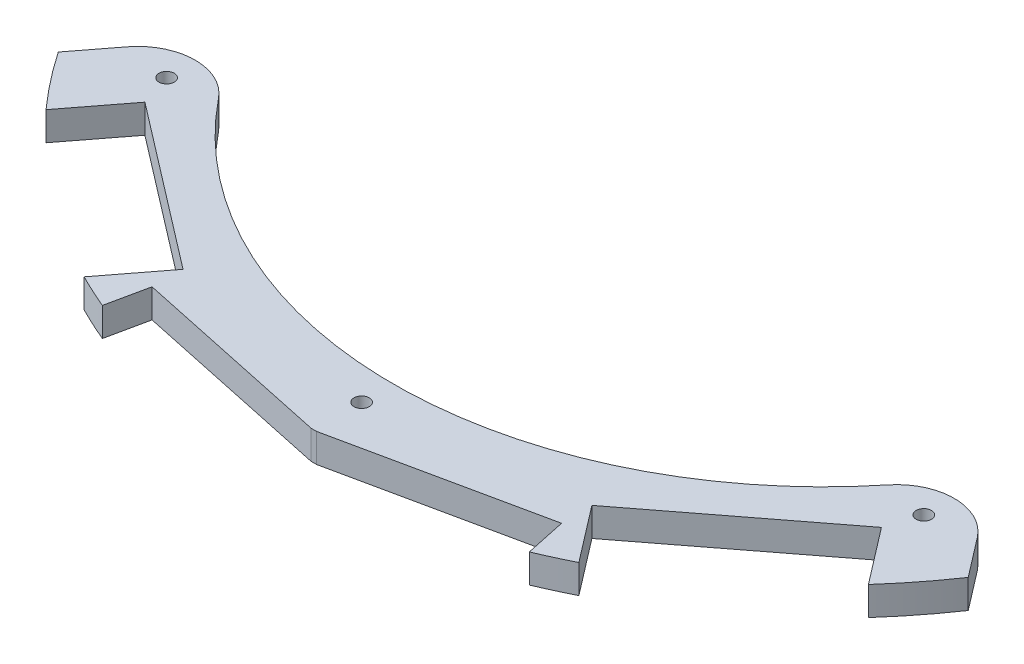
from build123d import *

# Parameters (mm, degrees)
SKETCH1_R           = 1.70053
BOSS_EXTRUDE1_DEPTH = 6.35


with BuildPart() as part:
    # Sketch1 → Boss-Extrude1 (new body)
    with BuildSketch(Plane(origin=(0, 0, 0), x_dir=(1, 0, 0), z_dir=(0, 1, 0))):
        with BuildLine():
            Line((100.72984212, 33.562647915), (94.097535909, 42.20603765))
            ThreePointArc((94.097535909, 42.20603765), (84.176111379, 47.17383179), (74.137013371, 42.448352501))
            ThreePointArc((74.137013371, 42.448352501), (0, 7.00024), (-74.137013371, 42.448352501))
            ThreePointArc((-74.137013371, 42.448352501), (-84.176111379, 47.17383179), (-94.097535909, 42.20603765))
            Line((-94.097535909, 42.20603765), (-100.72984212, 33.562647915))
            ThreePointArc((-100.72984212, 33.562647915), (-96.085326852, 27.20294582), (-91.039926176, 21.156354646))
            Line((-91.039926176, 21.156354646), (-81.532472576, 33.546709409))
            Line((-81.532472576, 33.546709409), (-63.396415217, 19.630423142))
            Line((-63.396415217, 19.630423142), (-45.260357858, 5.714136875))
            Line((-45.260357858, 5.714136875), (-54.767811458, -6.676217888))
            ThreePointArc((-54.767811458, -6.676217888), (-51.042995201, -8.470575753), (-47.259480127, -10.137606043))
            Line((-47.259480127, -10.137606043), (-45.332616871, -1.072427153))
            Line((-45.332616871, -1.072427153), (-0.611708566, -10.578149657))
            Line((-0.611708566, -10.578149657), (0.611708566, -10.578149657))
            Line((0.611708566, -10.578149657), (45.332616871, -1.072427153))
            Line((45.332616871, -1.072427153), (47.259480127, -10.137606043))
            ThreePointArc((47.259480127, -10.137606043), (51.042995201, -8.470575753), (54.767811458, -6.676217888))
            Line((54.767811458, -6.676217888), (45.260357858, 5.714136875))
            Line((45.260357858, 5.714136875), (63.396415217, 19.630423142))
            Line((63.396415217, 19.630423142), (81.532472576, 33.546709409))
            Line((81.532472576, 33.546709409), (91.039926176, 21.156354646))
            ThreePointArc((91.039926176, 21.156354646), (96.085326852, 27.20294582), (100.72984212, 33.562647915))
        make_face()
        with Locations(Location((83.82, 40.64, 0), (0, 0, 270))):
            Circle(SKETCH1_R, mode=Mode.SUBTRACT)
        with Locations(Location((-83.82, 40.64, 0), (0, 0, 90))):
            Circle(SKETCH1_R, mode=Mode.SUBTRACT)
        with Locations(Location((0, 0, 0), (0, 0, 270))):
            Circle(SKETCH1_R, mode=Mode.SUBTRACT)
    extrude(amount=BOSS_EXTRUDE1_DEPTH)


solid = part.part
